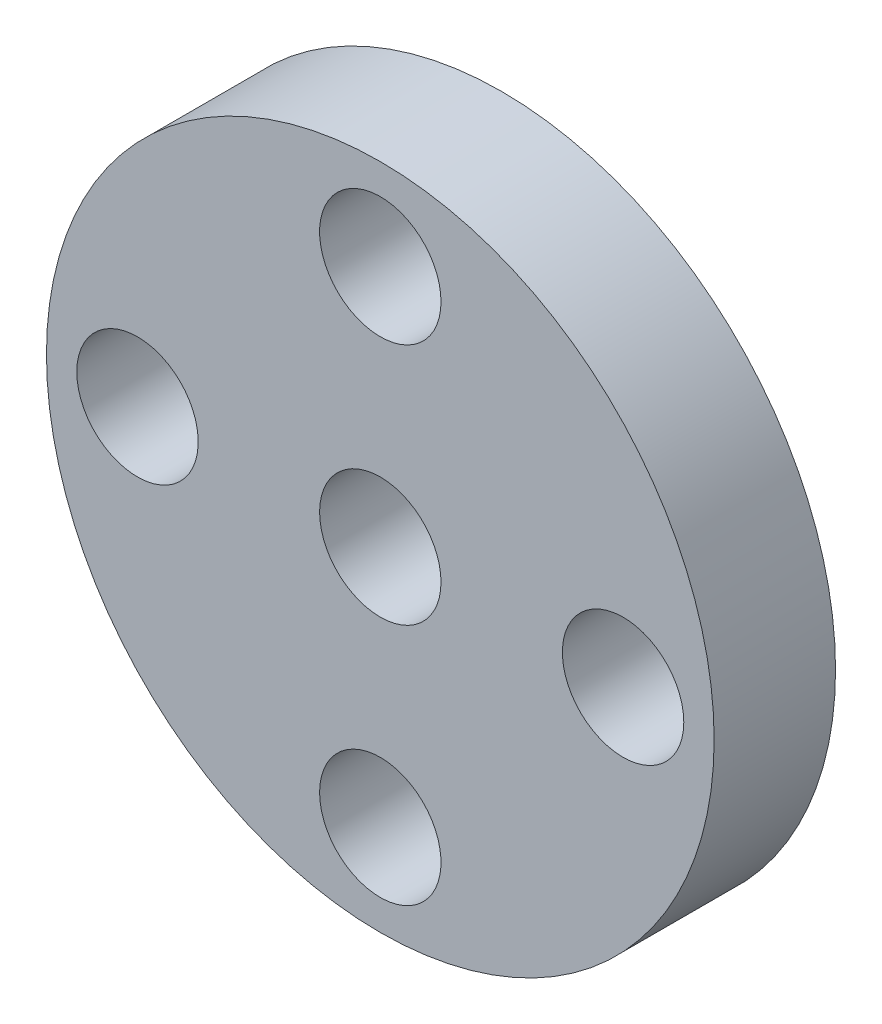
from build123d import *
from build123d.topology import SkipClean

# Parameters (mm, degrees)
IZIM1_R                     = 11
IZIM1_R_2                   = 2
Y_KSEKLIK_EKSTR_ZYON1_DEPTH = 4
Y_KSEKLIK_EKSTR_ZYON2_START = 4
IZIM2_R                     = 4
IZIM2_R_2                   = 2
Y_KSEKLIK_EKSTR_ZYON2_DEPTH = 4


with BuildPart() as part:
    # Çizim1 → Yükseklik-Ekstrüzyon1 (new body)
    with BuildSketch(Plane.XY):
        Circle(IZIM1_R)
        Circle(IZIM1_R_2, mode=Mode.SUBTRACT)
        with Locations((8, 0)):
            Circle(IZIM1_R_2, mode=Mode.SUBTRACT)
        with Locations((0, 8)):
            Circle(IZIM1_R_2, mode=Mode.SUBTRACT)
        with Locations(Location((-8, 0, 0), (0, 0, 180))):
            Circle(IZIM1_R_2, mode=Mode.SUBTRACT)
        with Locations(Location((0, -8, 0), (0, 0, 180))):
            Circle(IZIM1_R_2, mode=Mode.SUBTRACT)
    extrude(amount=Y_KSEKLIK_EKSTR_ZYON1_DEPTH)

    # Çizim2 → Yükseklik-Ekstrüzyon2 (add)
    with SkipClean():  # the faces are left unmerged after this step: merging them gives an invalid solid
        with BuildSketch(Plane(origin=(0, 0, 0), x_dir=(-1, 0, 0), z_dir=(0, 0, -1)).offset(Y_KSEKLIK_EKSTR_ZYON2_START)):
            with Locations(Location((0, 0, 0), (0, 0, 180))):
                Circle(IZIM2_R)
            Circle(IZIM2_R_2, mode=Mode.SUBTRACT)
        extrude(amount=-Y_KSEKLIK_EKSTR_ZYON2_DEPTH)


solid = part.part
